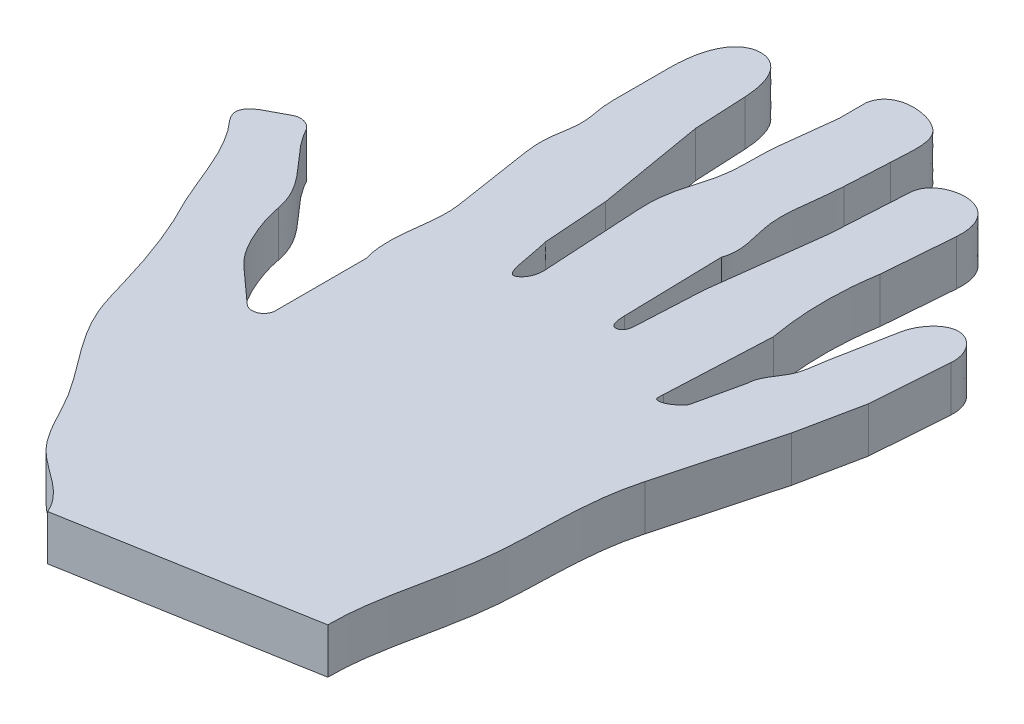
from build123d import *

# Parameters (mm, degrees)
BOSS_EXTRUDE1_DEPTH = 5


with BuildPart() as part:
    # Sketch2 → Boss-Extrude1 (new, symmetric)
    with BuildSketch(Plane(origin=(0, 0, 0), x_dir=(1, 0, 0), z_dir=(0, 1, 0))):
        with BuildLine():
            Line((-26.256733318, -4.621811883), (26.256733318, 4.621811883))
            add(Edge.make_bspline(
                [(26.256733318, 4.621811883), (26.184213815, 15.085916031), (31.39165321, 29.814258677), (31.49706253, 51.001483219), (32.310967161, 61.220682563), (33.852524137, 66.913865214)],
                knots=[0, 0, 0, 0, 0.494424997, 0.733347689, 1, 1, 1, 1], degree=3))
            Line((33.852524137, 66.913865214), (40.738782221, 92.345766637))
            Line((40.738782221, 92.345766637), (43.646124542, 106.427209936))
            Line((43.646124542, 106.427209936), (44.883071586, 123.411989276))
            add(Edge.make_bspline(
                [(44.883071586, 123.411989276), (45.165968858, 127.296511075), (39.51243958, 133.247924763), (34.10170013, 127.000274405), (33.459732834, 123.660322727)],
                knots=[0, 0, 0, 0, 0.483944054, 1, 1, 1, 1], degree=3))
            Line((33.459732834, 123.660322727), (30.874052834, 110.20785199))
            add(Edge.make_bspline(
                [(30.874052834, 110.20785199), (30.441188575, 107.955796914), (30.382492539, 103.306549634), (26.469197062, 99.749533646), (26.401505216, 97.069243348)],
                knots=[0, 0, 0, 0, 0.456305085, 1, 1, 1, 1], degree=3))
            Line((26.401505216, 97.069243348), (24.112480314, 86.815627265))
            add(Edge.make_bspline(
                [(19.297009656, 85.594758963), (19.243310028, 84.436078608), (19.094221788, 83.779551656), (20.94092685, 83.84883977), (22.432820011, 84.791228368), (23.934643349, 86.019012094), (24.112480314, 86.815627265)],
                knots=[0, 0, 0, 0, 0.237088594, 0.343164698, 0.637099032, 1, 1, 1, 1], degree=3))
            Line((19.297009656, 85.594758963), (20.36986935, 108.743922061))
            add(Edge.make_bspline(
                [(20.36986935, 108.743922061), (18.251278635, 120.569230524), (20.184141466, 132.474697955)],
                knots=[0, 0, 0, 1, 1, 1], degree=2))
            Line((20.184141466, 132.474697955), (21.422956498, 148.01825596))
            add(Edge.make_bspline(
                [(7.886453521, 151.373444104), (8.061393397, 154.365422898), (14.846563419, 158.831947186), (21.951965108, 154.65578924), (21.422956498, 148.01825596)],
                knots=[0, 0, 0, 0, 0.394994292, 1, 1, 1, 1], degree=3))
            Line((7.886453521, 151.373444104), (6.902699472, 134.548399342))
            Line((6.902699472, 134.548399342), (3.833351323, 110.20785199))
            Line((3.833351323, 110.20785199), (3.066920681, 95.274901286))
            add(Edge.make_bspline(
                [(-0.02159186, 96.268060872), (0.027684192, 94.213368932), (0.698982676, 92.143081029), (2.980886645, 93.598634774), (3.066920681, 95.274901286)],
                knots=[0, 0, 0, 0, 0.545550965, 1, 1, 1, 1], degree=3))
            Line((-0.02159186, 96.268060872), (-0.548678979, 118.246316572))
            add(Edge.make_bspline(
                [(-0.548678979, 145.251149648), (-0.915294678, 138.529010173), (-3.210810949, 131.270798089), (0.756296252, 121.816903372), (-0.548678979, 118.246316572)],
                knots=[0, 0, 0, 0, 0.597212586, 1, 1, 1, 1], degree=3))
            Line((-0.548678979, 145.251149648), (-0.02159186, 154.915637957))
            add(Edge.make_bspline(
                [(-14.082777353, 163.613875502), (-13.206305071, 169.295741696), (1.271215934, 168.230121804), (0.295217837, 160.724551686), (-0.02159186, 154.915637957)],
                knots=[0, 0, 0, 0, 0.553573038, 1, 1, 1, 1], degree=3))
            Line((-14.082777353, 163.613875502), (-14.082777353, 157.668307031))
            Line((-14.082777353, 157.668307031), (-15.437192564, 146.056382878))
            add(Edge.make_bspline(
                [(-18.807351222, 118.246316572), (-18.982381461, 121.2419879), (-18.455286153, 126.104488932), (-15.165218042, 135.219180874), (-15.95219543, 141.641064615), (-15.437192564, 146.056382878)],
                knots=[0, 0, 0, 0, 0.292833424, 0.552751335, 1, 1, 1, 1], degree=3))
            Line((-18.807351222, 118.246316572), (-17.5232119, 96.268060872))
            add(Edge.make_bspline(
                [(-17.5232119, 96.268060872), (-17.478594365, 95.504424428), (-17.663345633, 93.471140535), (-20.69353647, 90.530305698), (-21.741686411, 96.30347421), (-22.907109211, 102.276516742), (-22.86389916, 101.686280236)],
                knots=[0, 0, 0, 0, 0.194417097, 0.332418866, 0.645495928, 1, 1, 1, 1], degree=3))
            Line((-22.86389916, 101.686280236), (-23.90977525, 115.972638208))
            Line((-23.90977525, 115.972638208), (-27.993649806, 139.977396961))
            Line((-27.993649806, 139.977396961), (-28.550247244, 151.373444104))
            add(Edge.make_bspline(
                [(-42.440153209, 148.603290137), (-42.440153209, 156.79216036), (-37.316684629, 164.65280226), (-28.960959781, 159.782572709), (-28.550247244, 151.373444104)],
                knots=[0, 0, 0, 0, 0.53295506, 1, 1, 1, 1], degree=3))
            Line((-42.440153209, 148.603290137), (-42.440153209, 136.189708956))
            add(Edge.make_bspline(
                [(-41.668742375, 113.346816451), (-42.19497911, 116.743472309), (-42.99597028, 120.794670458), (-40.892054429, 129.161378833), (-42.440153209, 132.975454736), (-42.440153209, 136.189708956)],
                knots=[0, 0, 0, 0, 0.356023336, 0.669759724, 1, 1, 1, 1], degree=3))
            Line((-41.668742375, 113.346816451), (-39.481532119, 99.229214921))
            add(Edge.make_bspline(
                [(-39.481532119, 78.865982655), (-40.911565275, 83.601148767), (-39.535583433, 90.33311796), (-39.159502682, 97.150638681), (-39.481532119, 99.229214921)],
                knots=[0, 0, 0, 0, 0.695290511, 1, 1, 1, 1], degree=3))
            Line((-39.481532119, 78.865982655), (-39.481532119, 58.869061477))
            ThreePointArc((-39.481532119, 58.869061477), (-41.025725344, 56.493083351), (-43.824049084, 56.939389322))
            Line((-43.824049084, 56.939389322), (-51.36854474, 63.752158858))
            add(Edge.make_bspline(
                [(-58.832024896, 78.898041634), (-58.300951882, 75.958851634), (-56.370745123, 70.436918613), (-53.409290505, 65.594976618), (-51.36854474, 63.752158858)],
                knots=[0, 0, 0, 0, 0.533943101, 1, 1, 1, 1], degree=3))
            add(Edge.make_bspline(
                [(-58.832024896, 78.898041634), (-59.478052008, 82.473437818), (-63.45603922, 88.190679665), (-68.86425409, 93.338806019), (-71.187669739, 97.817450241), (-73.65768789, 98.799246852), (-78.090300121, 96.062640584), (-83.851775402, 94.152494508), (-80.98007287, 90.259003836)],
                knots=[0, 0, 0, 0, 0.267502676, 0.557706983, 0.582680153, 0.669254855, 0.724556218, 1, 1, 1, 1], degree=3))
            add(Edge.make_bspline(
                [(-80.98007287, 90.259003836), (-75.738710871, 84.470000229), (-73.6189357, 76.77203837), (-70.391217911, 69.829235803)],
                knots=[0, 0, 0, 0, 1, 1, 1, 1], degree=3))
            add(Edge.make_bspline(
                [(-70.391217911, 69.829235803), (-66.692008689, 62.860526967), (-62.867029651, 52.543349529), (-60.086598326, 42.060405741), (-58.905467069, 39.24574179)],
                knots=[0, 0, 0, 0, 0.723669094, 1, 1, 1, 1], degree=3))
            add(Edge.make_bspline(
                [(-26.256733318, -4.621811883), (-28.60669032, 0.892454726), (-39.270850453, 4.868841767), (-44.850488779, 18.875590893), (-52.803189433, 28.816690746), (-57.345558393, 35.528442216), (-58.905467069, 39.24574179)],
                knots=[0, 0, 0, 0, 0.306364848, 0.556646261, 0.785775409, 1, 1, 1, 1], degree=3))
        make_face()
    extrude(amount=BOSS_EXTRUDE1_DEPTH, both=True)


solid = part.part
